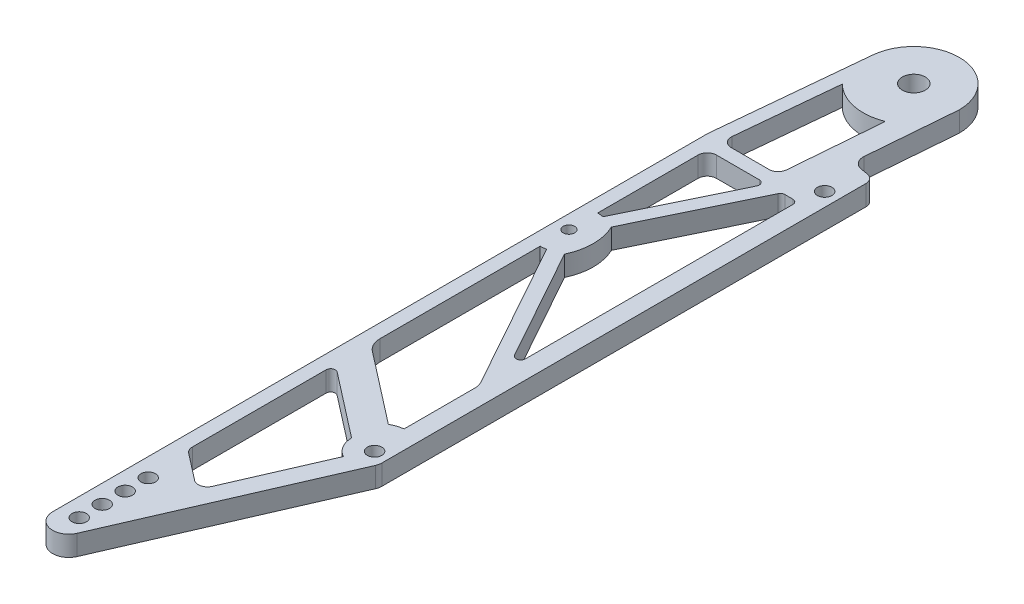
from build123d import *

# Parameters (mm, degrees)
SKETCH2_R           = 3.175
SKETCH2_R_2         = 2
SKETCH2_R_3         = 1.5875
SKETCH2_R_4         = 1.999999991
BOSS_EXTRUDE1_DEPTH = 5.588


with BuildPart() as part:
    # Sketch2 → Boss-Extrude1 (new body)
    with BuildSketch(Plane(origin=(0, 0, 0), x_dir=(1, 0, 0), z_dir=(0, 1, 0))):
        with BuildLine():
            Line((15.15555913, -28.018449791), (13.238676936, -27.713033224))
            ThreePointArc((13.238676936, -27.713033224), (11.241051513, -26.538356195), (10.573787778, -24.319092227))
            Line((10.573787778, -24.319092227), (12.5603, 0))
            ThreePointArc((12.5603, 0), (0.603657177, 12.545785512), (-12.502275592, 1.2059192))
            Line((-12.502275592, 1.2059192), (-16.498266045, -40.222207921))
            ThreePointArc((-16.498266045, -40.222207921), (-16.507064815, -40.344000039), (-16.51, -40.466074291))
            Line((-16.51, -40.466074291), (-16.51, -221.328861788))
            ThreePointArc((-16.51, -221.328861788), (-12.970187584, -225.680718913), (-7.988667969, -223.101301399))
            Line((-7.988667969, -223.101301399), (16.979901226, -165.677523619))
            ThreePointArc((16.979901226, -165.677523619), (17.216065593, -164.934164738), (17.295902343, -164.158289667))
            Line((17.295902343, -164.158289667), (17.295902343, -30.526810701))
            ThreePointArc((17.295902343, -30.526810701), (16.688093876, -28.878103365), (15.15555913, -28.018449791))
        make_face()
        with Locations(Location((0, 0, 0), (0, 0, 270))):
            Circle(SKETCH2_R, mode=Mode.SUBTRACT)
        with Locations(Location((-11.43, -219.075, 0), (0, 0, 270))):
            Circle(SKETCH2_R_2, mode=Mode.SUBTRACT)
        with Locations(Location((-11.43, -212.725, 0), (0, 0, 270))):
            Circle(SKETCH2_R_2, mode=Mode.SUBTRACT)
        with Locations(Location((-11.43, -206.375, 0), (0, 0, 270))):
            Circle(SKETCH2_R_2, mode=Mode.SUBTRACT)
        with Locations(Location((-11.43, -200.025, 0), (0, 0, 270))):
            Circle(SKETCH2_R_2, mode=Mode.SUBTRACT)
        with Locations(Location((-12.7, -82.55, 0), (0, 0, 270))):
            Circle(SKETCH2_R_3, mode=Mode.SUBTRACT)
        with Locations(Location((13.485902343, -38.1, 0), (0, 0, 270))):
            Circle(SKETCH2_R_4, mode=Mode.SUBTRACT)
        with Locations(Location((13.485902343, -162.410770806, 0), (0, 0, 270))):
            Circle(SKETCH2_R_2, mode=Mode.SUBTRACT)
        with BuildLine():
            Line((10.438542905, -167.981776143), (-0.534170778, -193.217289931))
            ThreePointArc((-0.534170778, -193.217289931), (-2.234040931, -194.665234867), (-4.420389569, -194.211381682))
            Line((-4.420389569, -194.211381682), (-11.716886202, -188.551043102))
            ThreePointArc((-11.716886202, -188.551043102), (-12.441018517, -187.661516081), (-12.7, -186.544128716))
            Line((-12.7, -186.544128716), (-12.7, -149.615408258))
            ThreePointArc((-12.7, -149.615408258), (-11.988693683, -148.474898999), (-10.651556899, -148.611951065))
            Line((-10.651556899, -148.611951065), (7.135902343, -162.410770806))
            ThreePointArc((7.135902343, -162.410770806), (8.023611961, -165.648962244), (10.438542905, -167.981776143))
        make_face(mode=Mode.SUBTRACT)
        with BuildLine():
            Line((-7.44734835, -76.074408803), (7.575478058, -45.053638233))
            ThreePointArc((7.575478058, -45.053638233), (8.043996088, -44.531101035), (8.718495671, -44.337182032))
            Line((8.718495671, -44.337182032), (10.945902343, -44.337182032))
            ThreePointArc((10.945902343, -44.337182032), (11.843927955, -44.70915642), (12.215902343, -45.607182032))
            Line((12.215902343, -45.607182032), (12.215902343, -119.492817968))
            ThreePointArc((12.215902343, -119.492817968), (11.264685124, -120.722158254), (9.835937715, -120.109971535))
            Line((9.835937715, -120.109971535), (-7.44734835, -89.025591197))
            ThreePointArc((-7.44734835, -89.025591197), (-5.976040897, -82.55), (-7.44734835, -76.074408803))
        make_face(mode=Mode.SUBTRACT)
        with BuildLine():
            Line((-12.431479451, -37.743315662), (-9.755434212, -9.99962016))
            ThreePointArc((-9.755434212, -9.99962016), (-2.756273581, -13.695395429), (5.127655889, -12.99492382))
            Line((5.127655889, -12.99492382), (3.069264048, -38.19397392))
            ThreePointArc((3.069264048, -38.19397392), (2.259083254, -39.854914801), (0.537695935, -40.527182032))
            Line((0.537695935, -40.527182032), (-9.903213406, -40.527182032))
            ThreePointArc((-9.903213406, -40.527182032), (-11.783508673, -39.694838236), (-12.431479451, -37.743315662))
        make_face(mode=Mode.SUBTRACT)
        with BuildLine():
            Line((1.663048834, -44.337182032), (-10.16, -44.337182032))
            ThreePointArc((-10.16, -44.337182032), (-11.956051224, -45.081130808), (-12.7, -46.877182032))
            Line((-12.7, -46.877182032), (-12.7, -74.6125))
            ThreePointArc((-12.7, -74.6125), (-11.873503915, -74.655646925), (-11.055993219, -74.784618621))
            Line((-11.055993219, -74.784618621), (2.806066447, -46.160725831))
            ThreePointArc((2.806066447, -46.160725831), (2.739129831, -44.932682449), (1.663048834, -44.337182032))
        make_face(mode=Mode.SUBTRACT)
        with BuildLine():
            Line((8.923603828, -154.049487576), (-10.733772403, -138.80005889))
            ThreePointArc((-10.733772403, -138.80005889), (-12.182037035, -137.021004847), (-12.7, -134.786230117))
            Line((-12.7, -134.786230117), (-12.7, -90.4875))
            ThreePointArc((-12.7, -90.4875), (-11.888769677, -90.445936399), (-11.086035141, -90.321680879))
            Line((-11.086035141, -90.321680879), (11.575760855, -131.079432803))
            ThreePointArc((11.575760855, -131.079432803), (12.053263487, -132.272915946), (12.215902343, -133.548047069))
            Line((12.215902343, -133.548047069), (12.215902343, -152.970817152))
            ThreePointArc((12.215902343, -152.970817152), (10.520298026, -153.359206519), (8.923603828, -154.049487576))
        make_face(mode=Mode.SUBTRACT)
    extrude(amount=BOSS_EXTRUDE1_DEPTH)


solid = part.part
